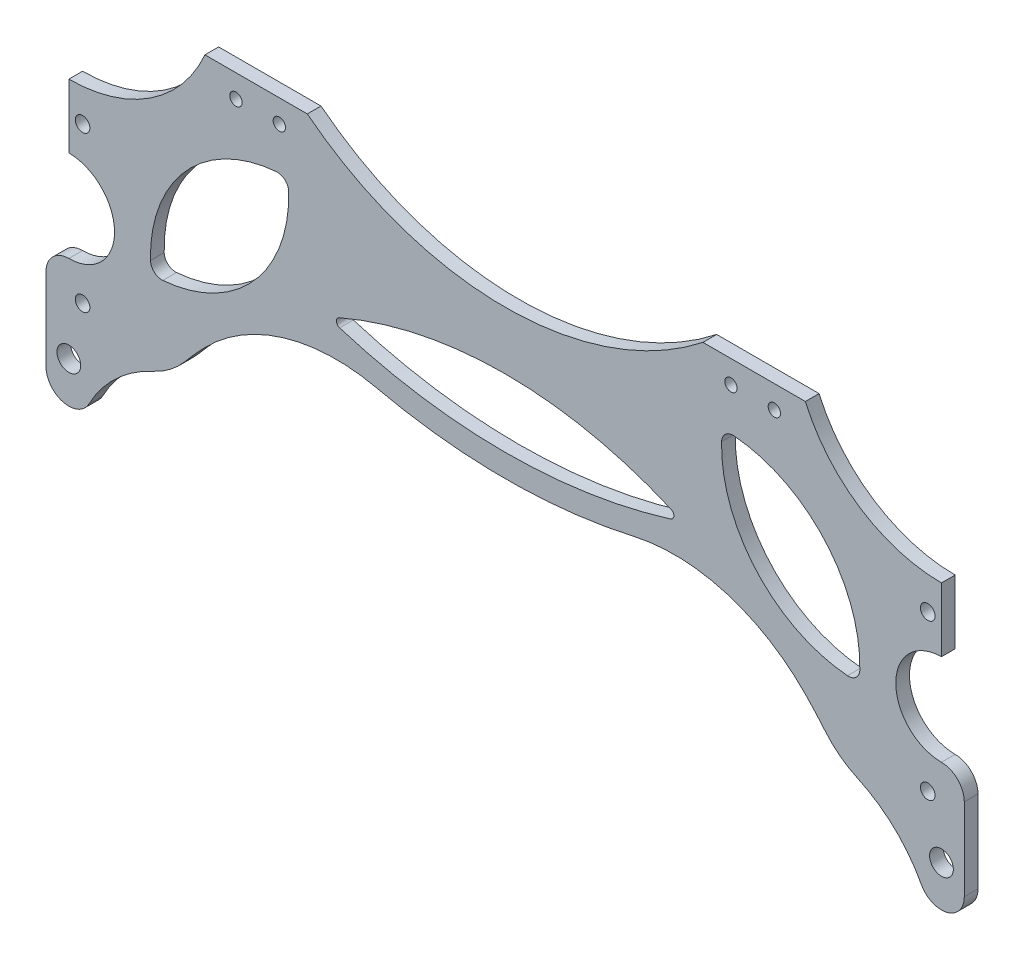
from build123d import *

# Parameters (mm, degrees)
EXTRUDE_1_DEPTH     = 3
EXTRUDE_1_2_DEPTH   = 3
FILLET_1_R          = 40
CUT_EXTRUDE_1_REACH = 103.333
FILLET_2_R          = 20
CUT_EXTRUDE_2_REACH = 103.333
SKETCH_4_R          = 1.6
FILLET_3_R          = 1
SKETCH_6_R          = 1.6
SKETCH_6_R_2        = 2.6
EXTRUDE_2_DEPTH     = 3
FILLET_4_R          = 30
FILLET_5_R          = 2.5
SKETCH_8_R          = 1.35
CUT_EXTRUDE_4_DEPTH = 10


with BuildPart() as part:
    # 草图1 → Extrude 1 (new body)
    with BuildSketch(Plane.XY):
        with BuildLine():
            ThreePointArc((-43.301270189, 33.75), (0, 18.75), (43.301270189, 33.75))
            Line((43.301270189, 33.75), (65.713257983, 33.75))
            ThreePointArc((65.713257983, 33.75), (77.699016881, 19.558549138), (95.5, 14.25))
            Line((95.5, 14.25), (95.5, 0.25))
            ThreePointArc((95.5, 0.25), (85.5, -9.75), (95.5, -19.75))
            Line((95.5, -19.75), (95.5, -33.75))
            Line((95.5, -33.75), (75.5, -33.75))
            ThreePointArc((75.5, -33.75), (0, 6.139830406), (-75.5, -33.75))
            Line((-75.5, -33.75), (-95.5, -33.75))
            Line((-95.5, -33.75), (-95.5, -19.75))
            ThreePointArc((-95.5, -19.75), (-85.5, -9.75), (-95.5, 0.25))
            Line((-95.5, 0.25), (-95.5, 14.25))
            ThreePointArc((-95.5, 14.25), (-77.699016881, 19.558549138), (-65.713257983, 33.75))
            Line((-65.713257983, 33.75), (-43.301270189, 33.75))
        make_face()
    extrude(amount=EXTRUDE_1_DEPTH)

    # 草图2 → Extrude 1 2 (add)
    with BuildSketch(Plane.XY.offset(3)):
        with BuildLine():
            ThreePointArc((-73.077723915, 9.270833333), (1.020159466, -13.745918659), (74.740241536, 10.453599796))
            Line((74.740241536, 10.453599796), (71.809251672, 14.50443902))
            ThreePointArc((71.809251672, 14.50443902), (0.980153213, -8.746078711), (-70.211930821, 13.368055556))
            Line((-70.211930821, 13.368055556), (-73.077723915, 9.270833333))
        make_face()
    extrude(amount=-EXTRUDE_1_2_DEPTH)

    # 圆角1
    fillet_1_edges = [part.edges().sort_by_distance(p)[0] for p in [
        (44.828445276, -5.609375393, 1.5),
        (-44.828445276, -5.609375393, 1.5),
    ]]
    fillet(fillet_1_edges, radius=FILLET_1_R)

    # 草图3 → 切除-拉伸1 (cut, up to next)
    with BuildSketch(Plane.XY.offset(3), mode=Mode.PRIVATE) as cut_extrude_1_sk1:
        with BuildLine():
            ThreePointArc((-77.464525403, -13.719576202), (-55.070861932, -3.793658796), (-47.54009497, 19.514870736))
            ThreePointArc((-47.54009497, 19.514870736), (-69.933758441, 9.588953331), (-77.464525403, -13.719576202))
        make_face()
    cut_extrude_1_tool1 = extrude(cut_extrude_1_sk1.sketch, amount=-CUT_EXTRUDE_1_REACH, mode=Mode.PRIVATE) & part.part
    # 草图3 → 切除-拉伸1 (cut, up to next)
    with BuildSketch(Plane.XY.offset(3), mode=Mode.PRIVATE) as cut_extrude_1_sk2:
        with BuildLine():
            ThreePointArc((77.464525403, -13.719576202), (69.933758441, 9.588953331), (47.54009497, 19.514870736))
            ThreePointArc((47.54009497, 19.514870736), (55.070861932, -3.793658796), (77.464525403, -13.719576202))
        make_face()
    cut_extrude_1_tool2 = extrude(cut_extrude_1_sk2.sketch, amount=-CUT_EXTRUDE_1_REACH, mode=Mode.PRIVATE) & part.part
    add(cut_extrude_1_tool1.solids().sort_by_distance((-62.50231, 2.897647, 3))[0], mode=Mode.SUBTRACT)
    add(cut_extrude_1_tool2.solids().sort_by_distance((62.50231, 2.897647, 3))[0], mode=Mode.SUBTRACT)

    # 圆角2
    fillet_2_edges = [part.edges().sort_by_distance(p)[0] for p in [
        (75.5, -33.75, 1.5),
        (-75.5, -33.75, 1.5),
    ]]
    fillet(fillet_2_edges, radius=FILLET_2_R)

    # 草图4 → 切除-拉伸2 (cut, up to next)
    with BuildSketch(Plane.XY.offset(3), mode=Mode.PRIVATE) as cut_extrude_2_sk1:
        with Locations((-92.5, -26.75)):
            Circle(SKETCH_4_R)
    cut_extrude_2_tool1 = extrude(cut_extrude_2_sk1.sketch, amount=-CUT_EXTRUDE_2_REACH, mode=Mode.PRIVATE) & part.part
    # 草图4 → 切除-拉伸2 (cut, up to next)
    with BuildSketch(Plane.XY.offset(3), mode=Mode.PRIVATE) as cut_extrude_2_sk2:
        with Locations((-92.5, 7.25)):
            Circle(SKETCH_4_R)
    cut_extrude_2_tool2 = extrude(cut_extrude_2_sk2.sketch, amount=-CUT_EXTRUDE_2_REACH, mode=Mode.PRIVATE) & part.part
    # 草图4 → 切除-拉伸2 (cut, up to next)
    with BuildSketch(Plane.XY.offset(3), mode=Mode.PRIVATE) as cut_extrude_2_sk3:
        with Locations((92.5, 7.25)):
            Circle(SKETCH_4_R)
    cut_extrude_2_tool3 = extrude(cut_extrude_2_sk3.sketch, amount=-CUT_EXTRUDE_2_REACH, mode=Mode.PRIVATE) & part.part
    # 草图4 → 切除-拉伸2 (cut, up to next)
    with BuildSketch(Plane.XY.offset(3), mode=Mode.PRIVATE) as cut_extrude_2_sk4:
        with Locations((92.5, -26.75)):
            Circle(SKETCH_4_R)
    cut_extrude_2_tool4 = extrude(cut_extrude_2_sk4.sketch, amount=-CUT_EXTRUDE_2_REACH, mode=Mode.PRIVATE) & part.part
    add(cut_extrude_2_tool1.solids().sort_by_distance((-92.5, -26.75, 3))[0], mode=Mode.SUBTRACT)
    add(cut_extrude_2_tool2.solids().sort_by_distance((-92.5, 7.25, 3))[0], mode=Mode.SUBTRACT)
    add(cut_extrude_2_tool3.solids().sort_by_distance((92.5, 7.25, 3))[0], mode=Mode.SUBTRACT)
    add(cut_extrude_2_tool4.solids().sort_by_distance((92.5, -26.75, 3))[0], mode=Mode.SUBTRACT)

    # 圆角3
    fillet_3_edges = [part.edges().sort_by_distance(p)[0] for p in [
        (38.722757726, -2.468750785, 1.5),
        (-38.722757726, -2.468750785, 1.5),
    ]]
    fillet(fillet_3_edges, radius=FILLET_3_R)

    # 草图6 → 凸台-拉伸2 (add)
    # profile 1 of 2: a face of its own
    with BuildSketch(Plane.XY.offset(3)):
        with BuildLine():
            Line((-90.5, -24.75), (-90.5, -42.75))
            ThreePointArc((-90.5, -42.75), (-95.5, -47.75), (-100.5, -42.75))
            Line((-100.5, -42.75), (-100.5, -24.75))
            ThreePointArc((-100.5, -24.75), (-95.5, -19.75), (-90.5, -24.75))
        make_face()
        with Locations((-92.5, -26.75)):
            Circle(SKETCH_6_R, mode=Mode.SUBTRACT)
        with Locations((-95.5, -38.75)):
            Circle(SKETCH_6_R_2, mode=Mode.SUBTRACT)
    # profile 2 of 2: a face of its own
    with BuildSketch(Plane.XY.offset(3)):
        with BuildLine():
            Line((90.5, -24.75), (90.5, -42.75))
            ThreePointArc((90.5, -42.75), (95.5, -47.75), (100.5, -42.75))
            Line((100.5, -42.75), (100.5, -24.75))
            ThreePointArc((100.5, -24.75), (95.5, -19.75), (90.5, -24.75))
        make_face()
        with Locations((92.5, -26.75)):
            Circle(SKETCH_6_R, mode=Mode.SUBTRACT)
        with Locations((95.5, -38.75)):
            Circle(SKETCH_6_R_2, mode=Mode.SUBTRACT)
    extrude(amount=-EXTRUDE_2_DEPTH)

    # 圆角4
    fillet_4_edges = [part.edges().sort_by_distance(p)[0] for p in [
        (90.5, -33.75, 1.5),
        (-90.5, -33.75, 1.5),
    ]]
    fillet(fillet_4_edges, radius=FILLET_4_R)

    # 圆角5
    fillet_5_edges = [part.edges().sort_by_distance(p)[0] for p in [
        (-77.464525403, -13.719576202, 1.5),
        (-47.54009497, 19.514870736, 1.5),
        (77.464525403, -13.719576202, 1.5),
        (47.54009497, 19.514870736, 1.5),
    ]]
    fillet(fillet_5_edges, radius=FILLET_5_R)

    # 草图8 → 切除-拉伸4 (cut)
    with BuildSketch(Plane(origin=(0, 0, 0), x_dir=(-1, 0, 0), z_dir=(0, 0, -1))):
        with Locations((-58.927062958, 28.75)):
            Circle(SKETCH_8_R)
        with Locations((-49.427062958, 28.75)):
            Circle(SKETCH_8_R)
        with Locations(Location((49.427062958, 28.75, 0), (0, 0, 180))):
            Circle(SKETCH_8_R)
        with Locations(Location((58.927062958, 28.75, 0), (0, 0, 180))):
            Circle(SKETCH_8_R)
    extrude(amount=-CUT_EXTRUDE_4_DEPTH, mode=Mode.SUBTRACT)


solid = part.part
